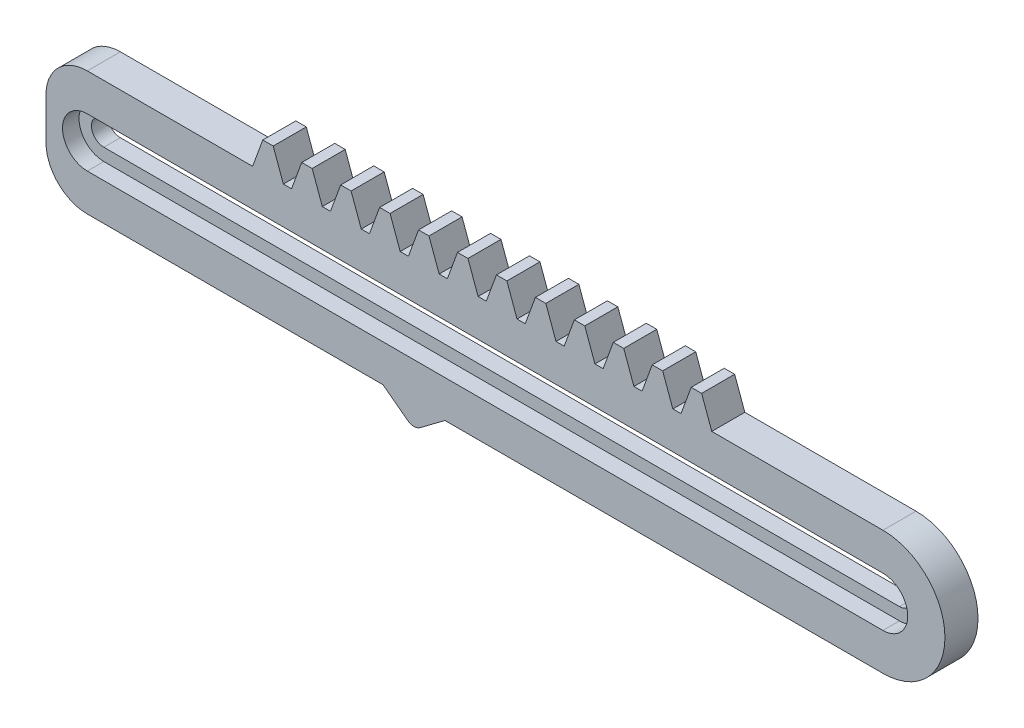
from build123d import *

# Parameters (mm, degrees)
BOSS_EXTRU_1_DEPTH      = 8
ENL_V_MAT_EXTRU_1_DEPTH = 4
CONG_2_R                = 10


with BuildPart() as part:
    # Esquisse1 → Boss.-Extru.1 (new body)
    with BuildSketch(Plane.XY):
        with BuildLine():
            Line((3.721082869, 15), (1.264283788, 21.75))
            Line((1.264283788, 21.75), (-1.264283788, 21.75))
            Line((-1.264283788, 21.75), (-3.721082869, 15))
            Line((-3.721082869, 15), (-53.721082869, 15))
            Line((-53.721082869, 15), (-53.721082869, -15))
            Line((-53.721082869, -15), (27.823144925, -15))
            Line((27.823144925, -15), (33.823144925, -19.5))
            ThreePointArc((33.823144925, -19.5), (35.323144925, -20), (36.823144925, -19.5))
            Line((36.823144925, -19.5), (42.823144925, -15))
            Line((42.823144925, -15), (148.823144925, -15))
            ThreePointArc((148.823144925, -15), (163.823144925, 0), (148.823144925, 15))
            Line((148.823144925, 15), (107.393640429, 15))
            Line((107.393640429, 15), (104.936841348, 21.75))
            Line((104.936841348, 21.75), (102.408273772, 21.75))
            Line((102.408273772, 21.75), (99.951474691, 15))
            Line((99.951474691, 15), (97.968862469, 15))
            Line((97.968862469, 15), (95.512063388, 21.75))
            Line((95.512063388, 21.75), (92.983495812, 21.75))
            Line((92.983495812, 21.75), (90.526696731, 15))
            Line((90.526696731, 15), (88.544084509, 15))
            Line((88.544084509, 15), (86.087285428, 21.75))
            Line((86.087285428, 21.75), (83.558717852, 21.75))
            Line((83.558717852, 21.75), (81.101918771, 15))
            Line((81.101918771, 15), (79.119306549, 15))
            Line((79.119306549, 15), (76.662507468, 21.75))
            Line((76.662507468, 21.75), (74.133939892, 21.75))
            Line((74.133939892, 21.75), (71.677140811, 15))
            Line((71.677140811, 15), (69.694528589, 15))
            Line((69.694528589, 15), (67.237729508, 21.75))
            Line((67.237729508, 21.75), (64.709161932, 21.75))
            Line((64.709161932, 21.75), (62.252362851, 15))
            Line((62.252362851, 15), (60.269750629, 15))
            Line((60.269750629, 15), (57.812951548, 21.75))
            Line((57.812951548, 21.75), (55.284383972, 21.75))
            Line((55.284383972, 21.75), (52.827584891, 15))
            Line((52.827584891, 15), (50.844972669, 15))
            Line((50.844972669, 15), (48.388173588, 21.75))
            Line((48.388173588, 21.75), (45.859606012, 21.75))
            Line((45.859606012, 21.75), (43.402806931, 15))
            Line((43.402806931, 15), (41.420194709, 15))
            Line((41.420194709, 15), (38.963395628, 21.75))
            Line((38.963395628, 21.75), (36.434828052, 21.75))
            Line((36.434828052, 21.75), (33.978028971, 15))
            Line((33.978028971, 15), (31.995416749, 15))
            Line((31.995416749, 15), (29.538617668, 21.75))
            Line((29.538617668, 21.75), (27.010050092, 21.75))
            Line((27.010050092, 21.75), (24.553251011, 15))
            Line((24.553251011, 15), (22.570638789, 15))
            Line((22.570638789, 15), (20.113839708, 21.75))
            Line((20.113839708, 21.75), (17.585272132, 21.75))
            Line((17.585272132, 21.75), (15.128473051, 15))
            Line((15.128473051, 15), (13.145860829, 15))
            Line((13.145860829, 15), (10.689061748, 21.75))
            Line((10.689061748, 21.75), (8.160494172, 21.75))
            Line((8.160494172, 21.75), (5.703695091, 15))
            Line((5.703695091, 15), (3.721082869, 15))
        make_face()
        with BuildLine():
            Line((-43.721082869, 3), (148.823144925, 3))
            ThreePointArc((148.823144925, 3), (151.823144925, 0), (148.823144925, -3))
            Line((148.823144925, -3), (-43.721082869, -3))
            ThreePointArc((-43.721082869, -3), (-46.721082869, 0), (-43.721082869, 3))
        make_face(mode=Mode.SUBTRACT)
    extrude(amount=BOSS_EXTRU_1_DEPTH)

    # Esquisse2 → Enlèv. mat.-Extru.1 (cut)
    with BuildSketch(Plane.XY.offset(8)):
        with BuildLine():
            Line((-43.721082869, 6), (148.823144925, 6))
            ThreePointArc((148.823144925, 6), (154.823144925, 0), (148.823144925, -6))
            Line((148.823144925, -6), (-43.721082869, -6))
            ThreePointArc((-43.721082869, -6), (-49.721082869, 0), (-43.721082869, 6))
        make_face()
    extrude(amount=-ENL_V_MAT_EXTRU_1_DEPTH, mode=Mode.SUBTRACT)

    # Congé2
    cong_2_edges = [part.edges().sort_by_distance(p)[0] for p in [
        (-53.721082869, -15, 4),
        (-53.721082869, 15, 4),
    ]]
    fillet(cong_2_edges, radius=CONG_2_R)


solid = part.part
